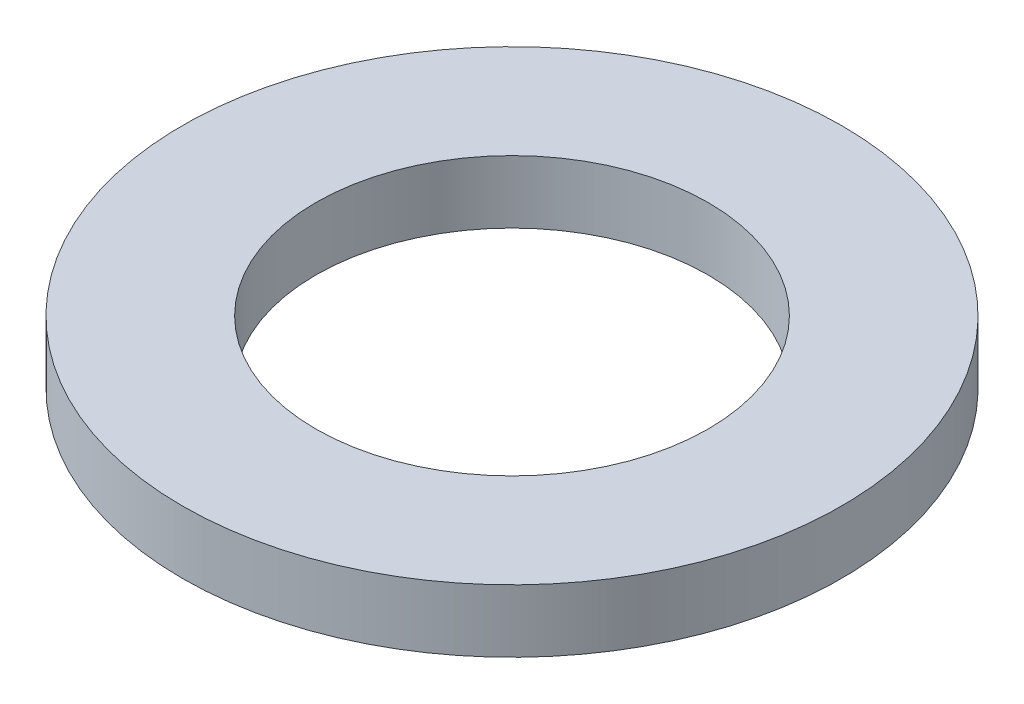
from build123d import *

# Parameters (mm, degrees)
SKETCH_1_R      = 21
SKETCH_1_R_2    = 12.5
EXTRUDE_1_DEPTH = 4


with BuildPart() as part:
    # 草图1 → 凸台-拉伸1 (new body)
    with BuildSketch(Plane(origin=(0, 0, 0), x_dir=(1, 0, 0), z_dir=(0, 1, 0))):
        with Locations(Location((0, 0, 0), (0, 0, 270))):
            Circle(SKETCH_1_R)
        with Locations(Location((0, 0, 0), (0, 0, 270))):
            Circle(SKETCH_1_R_2, mode=Mode.SUBTRACT)
    extrude(amount=EXTRUDE_1_DEPTH)


solid = part.part
